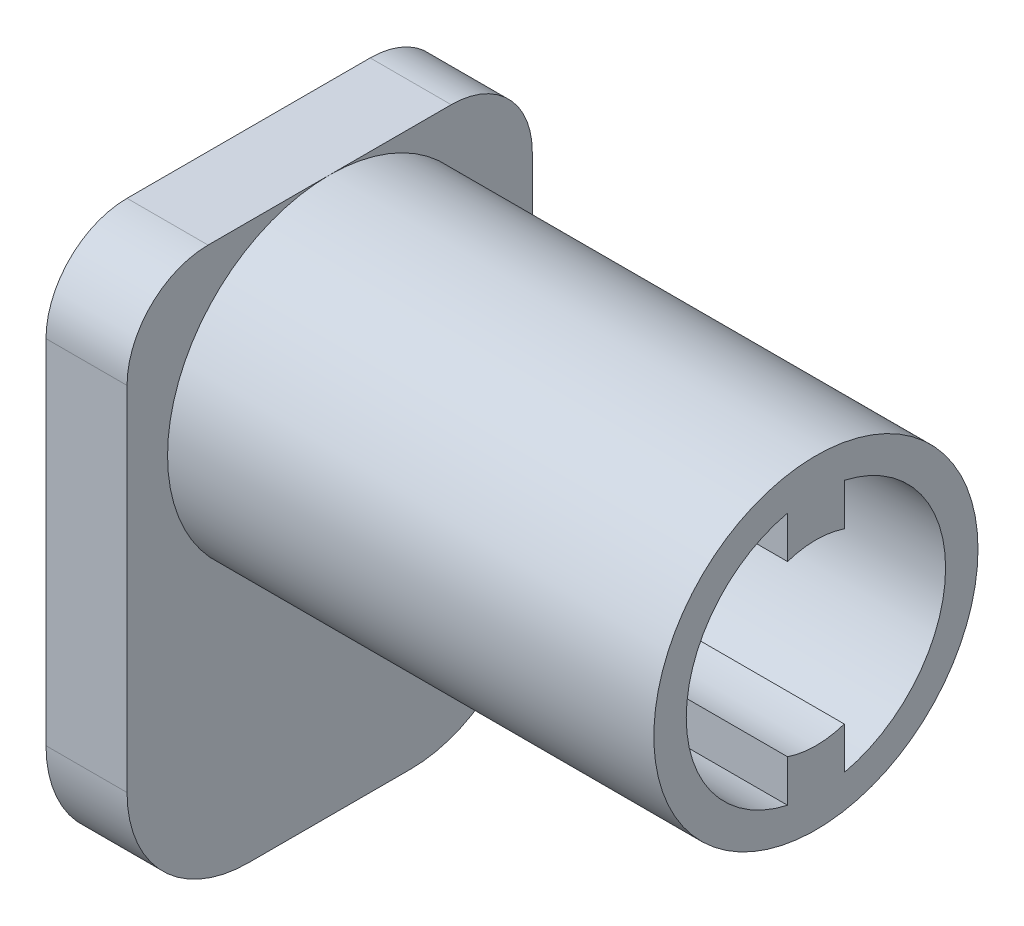
from build123d import *

# Parameters (mm, degrees)
SKETCH2_R           = 4
BOSS_EXTRUDE1_DEPTH = 12
SKETCH3_W           = 10
SKETCH3_H           = 13.7
BOSS_EXTRUDE2_DEPTH = 2
SKETCH4_R           = 3.2
CUT_EXTRUDE1_DEPTH  = 12
SKETCH7_R           = 1.6
CUT_EXTRUDE4_DEPTH  = 18.750774631
BOSS_EXTRUDE3_START = -14
BOSS_EXTRUDE3_DEPTH = 14
FILLET2_R           = 2
FILLET3_R           = 3


with BuildPart() as part:
    # Sketch2 → Boss-Extrude1 (new body)
    with BuildSketch(Plane(origin=(0, 0, 0), x_dir=(0, 0, -1), z_dir=(1, 0, 0))):
        Circle(SKETCH2_R)
    extrude(amount=-BOSS_EXTRUDE1_DEPTH)

    # Sketch3 → Boss-Extrude2 (add)
    with BuildSketch(Plane.ZY.offset(12)):
        with Locations((0, -2.85)):
            Rectangle(SKETCH3_W, SKETCH3_H)
    extrude(amount=BOSS_EXTRUDE2_DEPTH)

    # Sketch4 → Cut-Extrude1 (cut)
    with BuildSketch(Plane(origin=(0, 0, 0), x_dir=(0, 0, -1), z_dir=(1, 0, 0))):
        Circle(SKETCH4_R)
    extrude(amount=-CUT_EXTRUDE1_DEPTH, mode=Mode.SUBTRACT)

    # Sketch7 → Cut-Extrude4 (cut, through all)
    with BuildSketch(Plane.ZY.offset(14)):
        Circle(SKETCH7_R)
    extrude(amount=-CUT_EXTRUDE4_DEPTH, mode=Mode.SUBTRACT)

    # Sketch6 → Boss-Extrude3 (add)
    with BuildSketch(Plane.ZY.offset(14).offset(BOSS_EXTRUDE3_START)):
        with BuildLine():
            Line((0.7, -2.861817604), (0.7, -2.085665361))
            ThreePointArc((0.7, -2.085665361), (0, -2.2), (-0.7, -2.085665361))
            Line((-0.7, -2.085665361), (-0.7, -2.861817604))
            Line((-0.7, -2.861817604), (-0.7, -3.122498999))
            ThreePointArc((-0.7, -3.122498999), (0, -3.2), (0.7, -3.122498999))
            Line((0.7, -3.122498999), (0.7, -2.861817604))
        make_face()
        with BuildLine():
            Line((-0.7, 2.085665361), (-0.7, 2.861817604))
            Line((-0.7, 2.861817604), (-0.7, 3.122498999))
            ThreePointArc((-0.7, 3.122498999), (0, 3.2), (0.7, 3.122498999))
            Line((0.7, 3.122498999), (0.7, 2.861817604))
            Line((0.7, 2.861817604), (0.7, 2.085665361))
            ThreePointArc((0.7, 2.085665361), (0, 2.2), (-0.7, 2.085665361))
        make_face()
    extrude(amount=BOSS_EXTRUDE3_DEPTH)

    # Fillet2
    fillet2_edges = [part.edges().sort_by_distance(p)[0] for p in [
        (-13, 4, -5),
        (-13, 4, 5),
    ]]
    fillet(fillet2_edges, radius=FILLET2_R)

    # Fillet3
    fillet3_edges = [part.edges().sort_by_distance(p)[0] for p in [
        (-13, -9.7, -5),
        (-13, -9.7, 5),
    ]]
    fillet(fillet3_edges, radius=FILLET3_R)


solid = part.part
